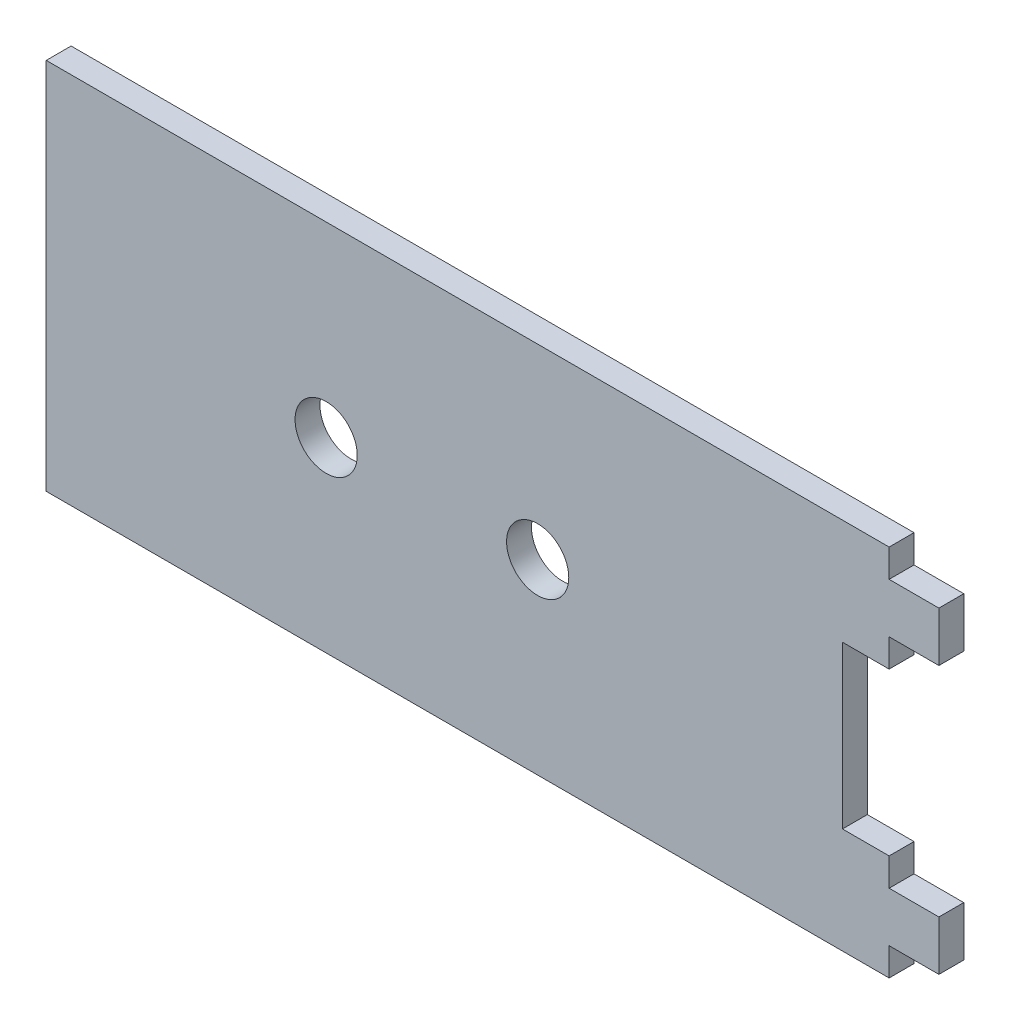
from build123d import *

# Parameters (mm, degrees)
SKETCH1_R           = 5
BOSS_EXTRUDE1_DEPTH = 4


with BuildPart() as part:
    # Sketch1 → Boss-Extrude1 (new body)
    with BuildSketch(Plane.XY):
        Polygon((49, 30), (56.5, 30), (56.5, 25.5), (64.5, 25.5), (64.5, 17.5), (56.5, 17.5), (56.5, 13), (49, 13), (49, -13), (56.5, -13), (56.5, -17.5), (64.5, -17.5), (64.5, -25.5), (56.5, -25.5), (56.5, -30), (49, -30), (-79, -30), (-79, 30), align=None)
        Circle(SKETCH1_R, mode=Mode.SUBTRACT)
        with Locations((-34, 0)):
            Circle(SKETCH1_R, mode=Mode.SUBTRACT)
    extrude(amount=BOSS_EXTRUDE1_DEPTH)


solid = part.part
